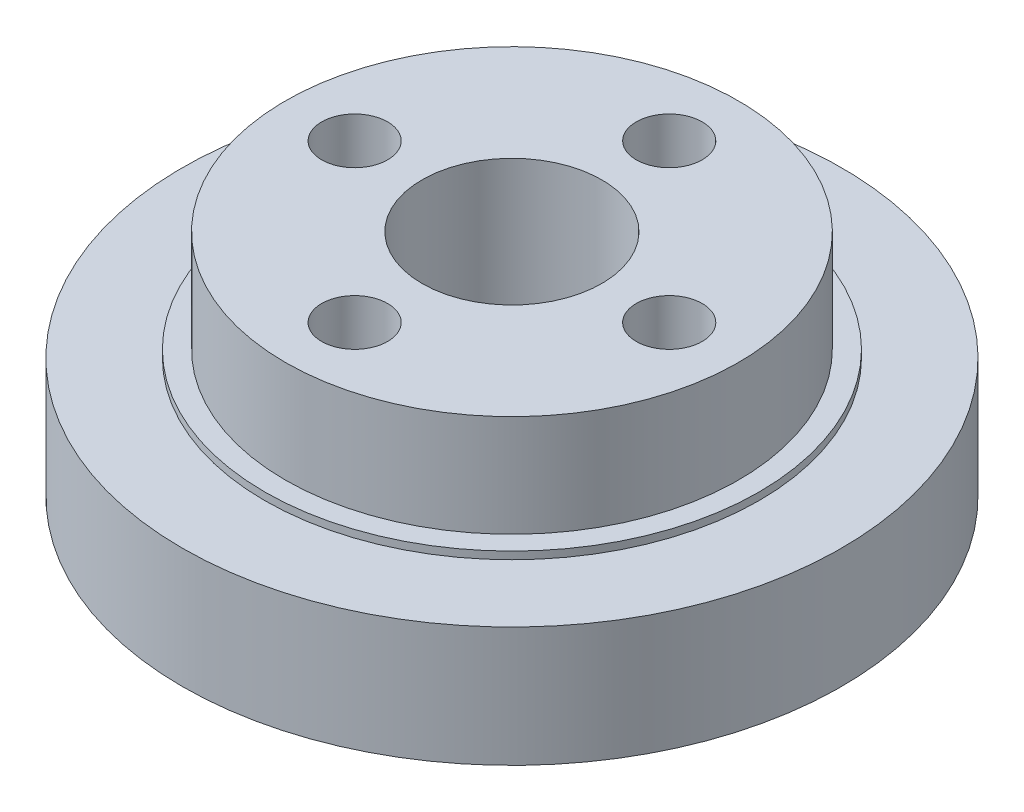
from build123d import *

# Parameters (mm, degrees)
SKETCH1_R           = 22
BOSS_EXTRUDE1_DEPTH = 8
SKETCH2_R           = 16.5
BOSS_EXTRUDE2_DEPTH = 0.5
SKETCH3_R           = 15.125
BOSS_EXTRUDE3_DEPTH = 6.8
SKETCH4_R           = 6
CUT_EXTRUDE1_DEPTH  = 35.671169579
SKETCH5_R           = 1.6
CUT_EXTRUDE2_DEPTH  = 7
CIRPATTERN1_COUNT   = 6
SKETCH6_R           = 2.2
CUT_EXTRUDE3_DEPTH  = 5.5
CIRPATTERN2_COUNT   = 4


with BuildPart() as part:
    # Sketch1 → Boss-Extrude1 (new body)
    with BuildSketch(Plane(origin=(0, 0, 0), x_dir=(1, 0, 0), z_dir=(0, 1, 0))):
        with Locations(Location((0, 0, 0), (0, 0, 270))):
            Circle(SKETCH1_R)
    extrude(amount=BOSS_EXTRUDE1_DEPTH)

    # Sketch2 → Boss-Extrude2 (add)
    with BuildSketch(Plane(origin=(0, 8, 0), x_dir=(1, 0, 0), z_dir=(0, 1, 0))):
        with Locations(Location((0, 0, 0), (0, 0, 270))):
            Circle(SKETCH2_R)
    extrude(amount=BOSS_EXTRUDE2_DEPTH)

    # Sketch3 → Boss-Extrude3 (add)
    with BuildSketch(Plane(origin=(0, 8.5, 0), x_dir=(1, 0, 0), z_dir=(0, 1, 0))):
        with Locations(Location((0, 0, 0), (0, 0, 270))):
            Circle(SKETCH3_R)
    extrude(amount=BOSS_EXTRUDE3_DEPTH)

    # Sketch4 → Cut-Extrude1 (cut, through all)
    with BuildSketch(Plane(origin=(0, 15.3, 0), x_dir=(1, 0, 0), z_dir=(0, 1, 0))):
        with Locations(Location((0, 0, 0), (0, 0, 270))):
            Circle(SKETCH4_R)
    extrude(amount=-CUT_EXTRUDE1_DEPTH, mode=Mode.SUBTRACT)

    # Sketch5 → Cut-Extrude2 (cut)
    with BuildSketch(Plane(origin=(0, 0, 0), x_dir=(1, 0, 0), z_dir=(0, 1, 0))):
        with Locations(Location((18.272234301, 2.894037603, 0), (0, 0, 270))):
            Circle(SKETCH5_R)
    cut_extrude2 = extrude(amount=CUT_EXTRUDE2_DEPTH, mode=Mode.SUBTRACT)

    # CirPattern1: Cut-Extrude2 ×6 about axis
    cirpattern1_axis = Axis((0, 0, 0), (0, 1, 0))
    for i in range(1, CIRPATTERN1_COUNT):
        add(cut_extrude2.rotate(cirpattern1_axis, i * 360 / CIRPATTERN1_COUNT), mode=Mode.SUBTRACT)

    # Sketch6 → Cut-Extrude3 (cut)
    with BuildSketch(Plane(origin=(0, 15.3, 0), x_dir=(1, 0, 0), z_dir=(0, 1, 0))):
        with Locations(Location((10.5, 0, 0), (0, 0, 270))):
            Circle(SKETCH6_R)
    cut_extrude3 = extrude(amount=-CUT_EXTRUDE3_DEPTH, mode=Mode.SUBTRACT)

    # CirPattern2: Cut-Extrude3 ×4 about axis
    cirpattern2_axis = Axis((0, 0, 0), (0, 1, 0))
    for i in range(1, CIRPATTERN2_COUNT):
        add(cut_extrude3.rotate(cirpattern2_axis, i * 360 / CIRPATTERN2_COUNT), mode=Mode.SUBTRACT)


solid = part.part
